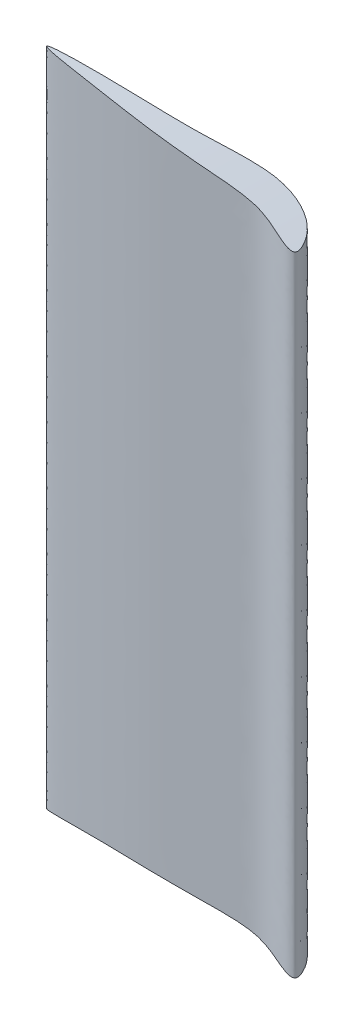
from build123d import *

# Parameters (mm, degrees)
ENL_V_MAT_EXTRU_1_DEPTH      = 17.261750047
ENL_V_MAT_EXTRU_1_DEPTH_BACK = 17.261750047
ENL_V_MAT_EXTRU_2_DEPTH      = 17.261750049
ENL_V_MAT_EXTRU_2_DEPTH_BACK = 17.261750049


with BuildPart() as part:
    # Balayage1: sweep along a path in Esquisse4
    with BuildLine(Plane(origin=(0, 0, 0), x_dir=(0, 0, -1), z_dir=(1, 0, 0))) as balayage1_path:
        Line((0.674671635, 0), (0.674671635, 15.4))
    # Esquisse2 → Balayage1 (sweep)
    with BuildSketch(Plane(origin=(0, 0, 0), x_dir=(1, 0, 0), z_dir=(0, 1, 0))):
        with BuildLine():
            add(Edge.make_bspline(
                [(5, 0.75), (5.01156508, 0.796443354), (4.82697014, 1.354556564), (4.130007474, 1.567151833), (3.469579901, 1.443052681), (2.956385437, 1.296721523), (1.95803661, 0.989839576), (-1.134750119, 0.651906211), (1.333402084, 0.609733098), (2.251558134, 0.635711879), (3.12820594, 0.738666213), (3.876496828, 0.887236324), (4.401600045, 0.838463984), (4.970424764, 0.631230982), (5, 0.75)],
                knots=[0, 0, 0, 0, 0.01967792, 0.137076218, 0.173086025, 0.21607146, 0.287020658, 0.517129769, 0.646238292, 0.741154992, 0.818777991, 0.897221633, 0.949677898, 1, 1, 1, 1], degree=3))
        make_face()
    sweep(path=balayage1_path.line)

    # Esquisse6 → Enlèv. mat.-Extru.1 (cut, two sides: drawn at the far end of the back side and taken through both)
    with BuildSketch(Plane.XY.offset(-ENL_V_MAT_EXTRU_1_DEPTH_BACK)):
        with BuildLine():
            Line((45.758499941, -11.676223231), (5.002753402, 0))
            ThreePointArc((5.002753402, 0), (2.51525274, 0.478450327), (-0.017659898, 0.508910525))
            Line((-0.017659898, 0.508910525), (-42.287472124, -2.75115686))
            Line((-42.287472124, -2.75115686), (-50.838733676, -87.109536323))
            Line((-50.838733676, -87.109536323), (37.20723839, -96.034602695))
            Line((37.20723839, -96.034602695), (45.758499941, -11.676223231))
        make_face()
    extrude(amount=ENL_V_MAT_EXTRU_1_DEPTH + ENL_V_MAT_EXTRU_1_DEPTH_BACK, mode=Mode.SUBTRACT)

    # Esquisse7 → Enlèv. mat.-Extru.2 (cut, two sides: drawn at the far end of the back side and taken through both)
    with BuildSketch(Plane.XY.offset(-ENL_V_MAT_EXTRU_2_DEPTH_BACK)):
        with BuildLine():
            Line((44.357506013, -1.454028771), (5.722917453, 12.544653033))
            ThreePointArc((5.722917453, 12.544653033), (2.142122822, 13.571296784), (-1.545228596, 14.1))
            Line((-1.545228596, 14.1), (-42.525252518, 17.138447777))
            Line((-42.525252518, 17.138447777), (-25.327437209, 97.503945663))
            Line((-25.327437209, 97.503945663), (61.555321322, 78.911469115))
            Line((61.555321322, 78.911469115), (44.357506013, -1.454028771))
        make_face()
    extrude(amount=ENL_V_MAT_EXTRU_2_DEPTH + ENL_V_MAT_EXTRU_2_DEPTH_BACK, mode=Mode.SUBTRACT)


solid = part.part
